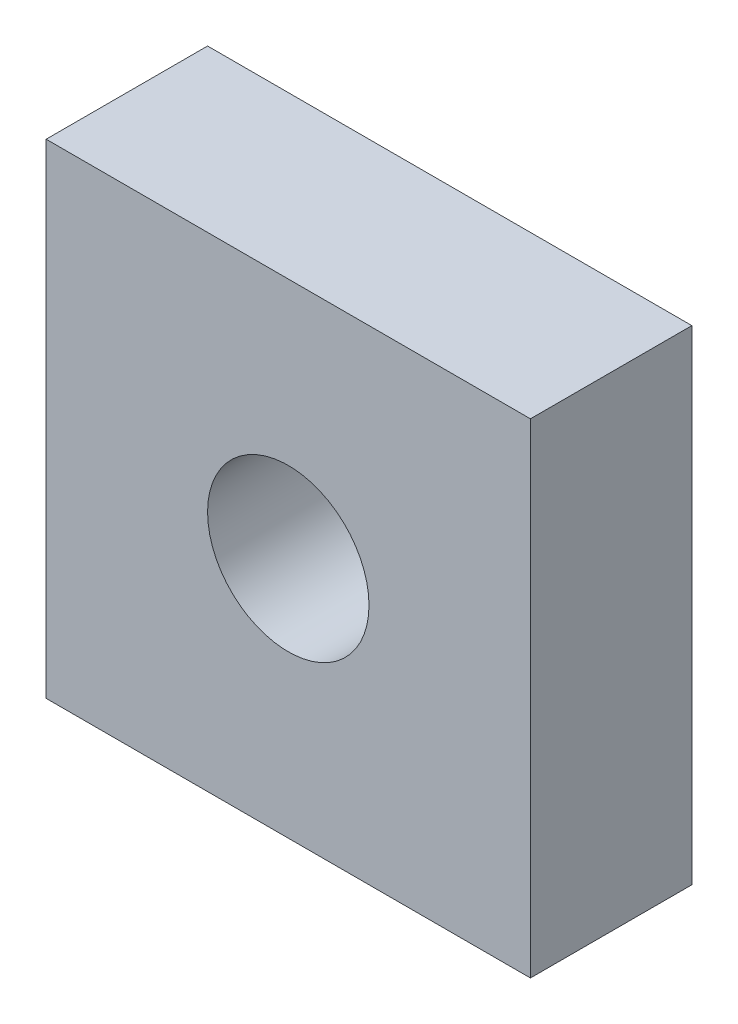
from build123d import *

# Parameters (mm, degrees)
ESQUISSE1_W             = 30
ESQUISSE1_H             = 30
BOSS_EXTRU_1_DEPTH      = 10
ESQUISSE2_R             = 5
ENL_V_MAT_EXTRU_1_DEPTH = 10


with BuildPart() as part:
    # Esquisse1 → Boss.-Extru.1 (new body)
    with BuildSketch(Plane.XY):
        Rectangle(ESQUISSE1_W, ESQUISSE1_H)
    extrude(amount=BOSS_EXTRU_1_DEPTH)

    # Esquisse2 → Enlèv. mat.-Extru.1 (cut)
    with BuildSketch(Plane.XY.offset(10)):
        Circle(ESQUISSE2_R)
    extrude(amount=-ENL_V_MAT_EXTRU_1_DEPTH, mode=Mode.SUBTRACT)


solid = part.part
